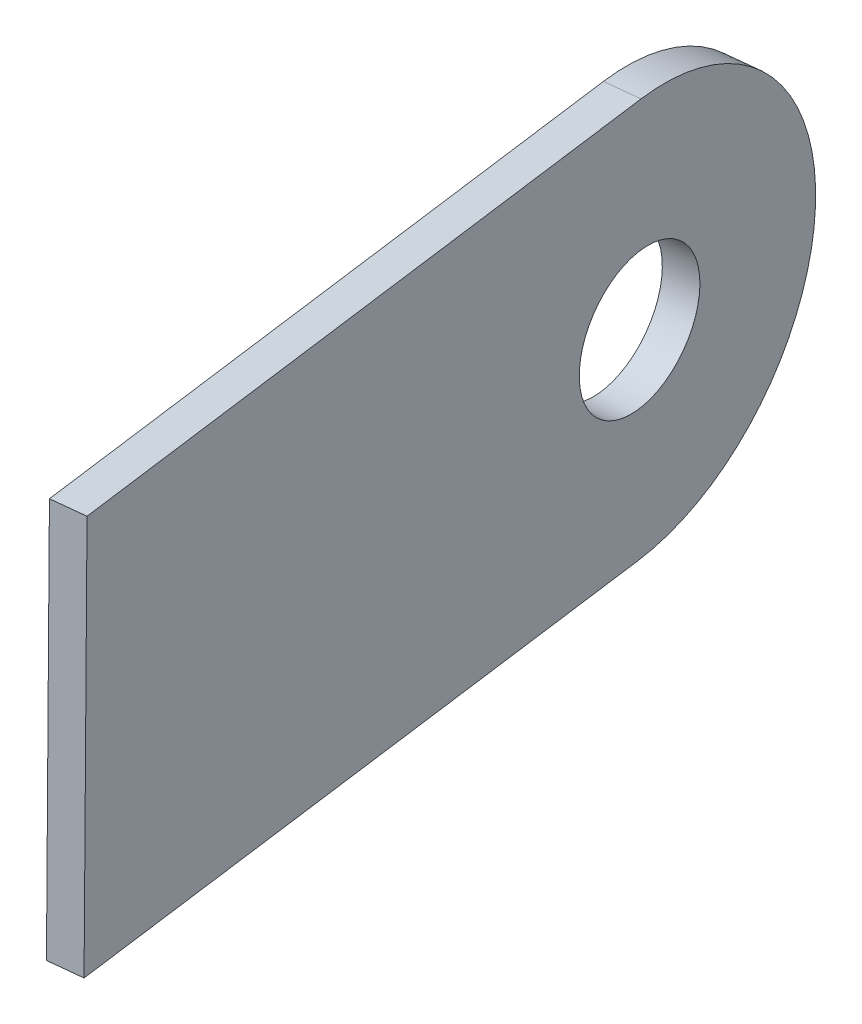
from build123d import *

# Parameters (mm, degrees)
SKETCH2_R           = 3.2639
BOSS_EXTRUDE1_DEPTH = 1.5875


with BuildPart() as part:
    # Sketch2 → Boss-Extrude1 (new body)
    with BuildSketch(Plane(origin=(368.936903679, -5.383850256, -45.587186199), x_dir=(-0.12260510858720207, 0.001789161069619477, -0.9924539214749405), z_dir=(0.9923482658198145, -0.014481214569019532, -0.12261816239453538))):
        with BuildLine():
            Line((479.608572167, 148.882124238), (509.579537559, 149.131157281))
            ThreePointArc((509.579537559, 149.131157281), (519.183350621, 139.685627933), (509.737821273, 130.081814871))
            Line((509.737821273, 130.081814871), (479.766855881, 129.832781828))
            Line((479.766855881, 129.832781828), (479.608572167, 148.882124238))
        make_face()
        with Locations(Location((509.658679416, 139.606486076, 0), (0, 0, 359.897477817))):
            Circle(SKETCH2_R, mode=Mode.SUBTRACT)
    extrude(amount=BOSS_EXTRUDE1_DEPTH)


solid = part.part
